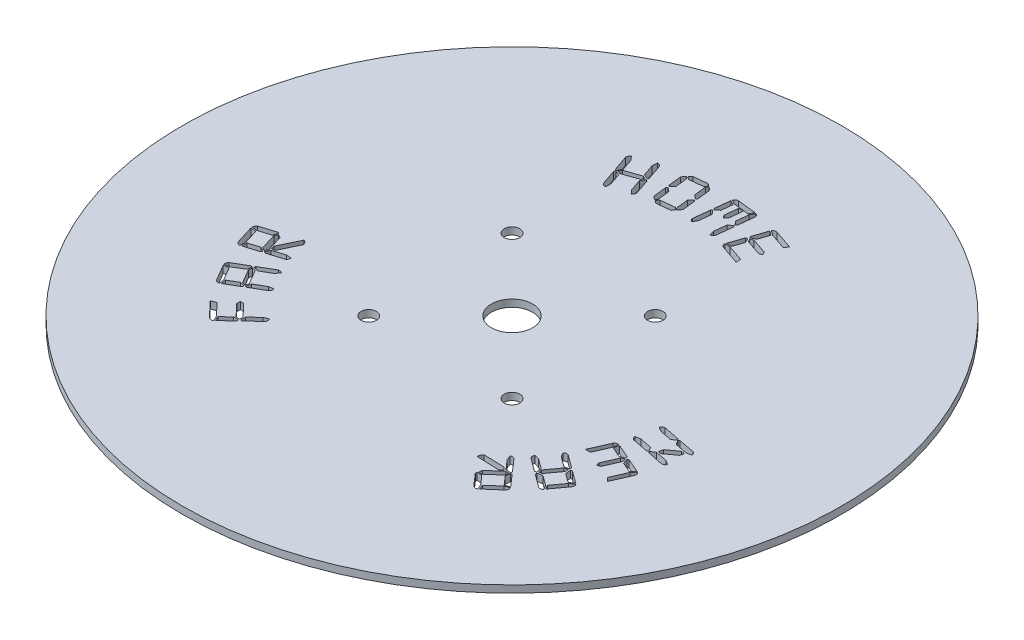
from build123d import *

# Parameters (mm, degrees)
SKETCH1_R           = 146.05
BOSS_EXTRUDE1_DEPTH = 3.175
SKETCH2_R           = 9.144
CUT_EXTRUDE1_DEPTH  = 3.175
SKETCH3_R           = 3.429
CUT_EXTRUDE2_DEPTH  = 3.175


with BuildPart() as part:
    # Sketch1 → Boss-Extrude1 (new body)
    with BuildSketch(Plane(origin=(0, 0, 0), x_dir=(1, 0, 0), z_dir=(0, 1, 0))):
        with Locations(Location((0, 0, 0), (0, 0, 270))):
            Circle(SKETCH1_R)
    extrude(amount=BOSS_EXTRUDE1_DEPTH)

    # Sketch2 → Cut-Extrude1 (cut)
    with BuildSketch(Plane(origin=(0, 3.175, 0), x_dir=(1, 0, 0), z_dir=(0, 1, 0))):
        with Locations(Location((0, 0, 0), (0, 0, 270))):
            Circle(SKETCH2_R)
        Polygon((31.408223038, 80.361871535), (32.15043083, 79.075378028), (30.773223038, 78.514598807), (23.89543083, 80.869046859), (23.153223038, 82.155540366), (24.53043083, 82.716319587), align=None)
        with BuildLine():
            Line((29.115625636, 70.238981924), (20.386437324, 73.228429976))
            add(Edge.make_bspline(
                [(20.386437324, 73.228429976), (20.308206491, 73.278910533), (20.158632768, 73.375427014), (19.960506837, 73.544292639), (19.793265108, 73.725547843), (19.66155019, 73.924112009), (19.561410759, 74.133968766), (19.487899467, 74.354938057), (19.457107157, 74.592381126), (19.458146887, 74.754035519), (19.458677584, 74.836546859)],
                knots=[0, 0, 0, 0, 1.139239353, 2.178172795, 3.179182683, 4.150304919, 5.083936223, 6.020900313, 6.98983155, 8, 8, 8, 8], degree=3))
            Line((19.458677584, 74.836546859), (21.809002259, 74.803559846))
            Line((21.809002259, 74.803559846), (28.954813947, 72.358397509))
            Line((28.954813947, 72.358397509), (29.115625636, 70.238981924))
        make_face()
        Polygon((19.619489272, 75.294241665), (21.800755506, 81.664858548), (22.497606155, 81.978235171), (23.57793083, 79.966027379), (21.982184077, 75.306611794), align=None)
        with BuildLine():
            Line((33.754424337, 86.340767639), (26.633352908, 88.777683223))
            Line((26.633352908, 88.777683223), (24.753093168, 90.196124781))
            add(Edge.make_bspline(
                [(24.753093168, 90.196124781), (24.801752832, 90.262669387), (24.897037259, 90.392975763), (25.075834585, 90.553073898), (25.264048274, 90.691978942), (25.473327199, 90.796146713), (25.699182363, 90.865799675), (25.941692479, 90.906850852), (26.202039321, 90.91931368), (26.380524095, 90.904655681), (26.47254122, 90.897098807)],
                knots=[0, 0, 0, 0, 1.006787646, 1.97147236, 2.924338132, 3.865236511, 4.818102283, 5.808721278, 6.870294853, 8, 8, 8, 8], degree=3))
            Line((26.47254122, 90.897098807), (35.176989272, 87.915897509))
            Line((35.176989272, 87.915897509), (33.754424337, 86.340767639))
        make_face()
        Polygon((26.427184077, 88.287001405), (24.835560701, 83.631709197), (22.745008753, 82.703949457), (22.386274986, 83.37193647), (24.56754122, 89.742553353), align=None)
        Polygon((10.423649508, 85.353448722), (9.252610547, 84.438059112), (8.312480677, 85.58848119), (8.963974183, 91.509650021), (11.075143014, 91.274617553), align=None)
        with BuildLine():
            Line((14.530532625, 83.856663008), (15.004720936, 83.287637034))
            Line((15.004720936, 83.287637034), (14.204785871, 76.07585132))
            add(Edge.make_bspline(
                [(14.204785871, 76.07585132), (14.172673007, 75.996398713), (14.109767556, 75.840760084), (13.979009278, 75.630349221), (13.831498412, 75.441311804), (13.656191061, 75.28375158), (13.459234008, 75.155237654), (13.242543941, 75.049869316), (13.001438811, 74.976666806), (12.832092118, 74.948264352), (12.745110547, 74.933675995)],
                knots=[0, 0, 0, 0, 1.048160122, 2.053226586, 3.023696917, 3.977513798, 4.925664685, 5.897303201, 6.919991485, 8, 8, 8, 8], degree=3))
            Line((12.745110547, 74.933675995), (12.180207949, 77.081955216))
            Line((12.180207949, 77.081955216), (12.77809756, 82.487701969))
            Line((12.77809756, 82.487701969), (14.530532625, 83.856663008))
        make_face()
        with BuildLine():
            Line((13.169818339, 91.447799371), (6.370370287, 92.198253917))
            Line((6.370370287, 92.198253917), (4.345792365, 93.224974696))
            add(Edge.make_bspline(
                [(4.345792365, 93.224974696), (4.380560264, 93.307246191), (4.448329292, 93.467608465), (4.586792176, 93.682965096), (4.745731724, 93.871773528), (4.926549488, 94.035761754), (5.138481934, 94.160883719), (5.36486679, 94.272773568), (5.62087693, 94.344865074), (5.799643588, 94.373146546), (5.892058599, 94.387766904)],
                knots=[0, 0, 0, 0, 1.04758277, 2.041931492, 2.992863463, 3.942149272, 4.891984118, 5.874199749, 6.901048696, 8, 8, 8, 8], degree=3))
            Line((5.892058599, 94.387766904), (14.258389768, 93.46413054))
            Line((14.258389768, 93.46413054), (13.169818339, 91.447799371))
        make_face()
        Polygon((6.312643014, 91.686955216), (5.772480677, 86.79663054), (4.020045612, 85.427669501), (3.549980677, 86.000818852), (4.288065092, 92.697182488), align=None)
        with BuildLine():
            Line((13.161571586, 85.976078592), (13.759461196, 91.381825345))
            Line((13.759461196, 91.381825345), (14.777935222, 93.356922748))
            add(Edge.make_bspline(
                [(14.777935222, 93.356922748), (14.860253989, 93.325072433), (15.020345313, 93.263130797), (15.234334111, 93.130750272), (15.428713683, 92.988275135), (15.590322893, 92.816851551), (15.723157178, 92.624115794), (15.832793132, 92.41161178), (15.909598712, 92.1757657), (15.941150471, 92.01035883), (15.957220936, 91.92611106)],
                knots=[0, 0, 0, 0, 1.079803383, 2.099972567, 3.07400507, 4.02756035, 4.971838706, 5.936496843, 6.948982343, 8, 8, 8, 8], degree=3))
            Line((15.957220936, 91.92611106), (15.161409248, 84.714325345))
            Line((15.161409248, 84.714325345), (14.575889768, 84.25663054))
            Line((14.575889768, 84.25663054), (13.161571586, 85.976078592))
        make_face()
        with BuildLine():
            Line((5.389006651, 83.30413054), (4.79111704, 77.898383787))
            Line((4.79111704, 77.898383787), (3.772643014, 75.923286384))
            add(Edge.make_bspline(
                [(3.772643014, 75.923286384), (3.690392531, 75.955225339), (3.530434004, 76.017339358), (3.314785633, 76.148939266), (3.123167691, 76.296385835), (2.960092385, 76.467242852), (2.82736807, 76.660250882), (2.718777619, 76.87166896), (2.639648443, 77.106811176), (2.609137488, 77.272518203), (2.5933573, 77.358221449)],
                knots=[0, 0, 0, 0, 1.078346281, 2.097138835, 3.080138305, 4.032406844, 4.975410977, 5.938767391, 6.933935817, 8, 8, 8, 8], degree=3))
            Line((2.5933573, 77.358221449), (3.393292365, 84.570007164))
            Line((3.393292365, 84.570007164), (3.974688469, 85.023578592))
            Line((3.974688469, 85.023578592), (5.389006651, 83.30413054))
        make_face()
        Polygon((-7.079524436, 92.118706184), (-13.194491968, 91.442472418), (-14.423258202, 92.374355535), (-13.429524436, 93.553641249), (-7.314556903, 94.229875015), (-6.085790669, 93.297991898), align=None)
        Polygon((-5.945595864, 86.890264625), (-6.543485475, 92.296011379), (-5.838388072, 93.157797093), (-4.374589371, 92.011498392), (-3.723095864, 86.090329561), (-4.193160799, 85.51718021), align=None)
        Polygon((-4.135433526, 85.001758132), (-3.554037423, 84.548186703), (-2.898420539, 78.622894496), (-4.073582877, 77.192082807), (-4.951862098, 77.880686703), (-5.549751708, 83.286433457), align=None)
        Polygon((-14.749004955, 84.350264625), (-15.334524436, 84.807959431), (-15.986017942, 90.729128262), (-14.810855604, 92.168186703), (-13.932576384, 91.479582807), (-13.334686773, 86.073836054), align=None)
        Polygon((-4.279751708, 76.936433457), (-5.273485475, 75.757147742), (-11.388453007, 75.080913976), (-12.617219241, 76.012797093), (-11.623485475, 77.192082807), (-5.508517942, 77.868316574), align=None)
        Polygon((-12.938842617, 82.470004885), (-12.340953007, 77.064258132), (-13.04605041, 76.202472418), (-14.509849111, 77.340524366), (-15.165465994, 83.265816574), (-14.691277682, 83.834842548), align=None)
        Polygon((-24.53915595, 82.708315981), (-23.161948157, 82.14753676), (-23.90415595, 80.861043254), (-30.765454651, 78.510718578), (-32.142662443, 79.071497799), (-31.400454651, 80.357991306), align=None)
        with BuildLine():
            Line((-22.54756504, 82.060945851), (-21.850714391, 81.751692604))
            Line((-21.850714391, 81.751692604), (-19.504513092, 74.890393903))
            add(Edge.make_bspline(
                [(-19.504513092, 74.890393903), (-19.500255122, 74.803700992), (-19.491906571, 74.633723221), (-19.528501415, 74.385706992), (-19.588584886, 74.15179337), (-19.685062054, 73.932420803), (-19.820014424, 73.731209754), (-19.980965711, 73.539306873), (-20.176827324, 73.364362585), (-20.326415823, 73.266614201), (-20.403409196, 73.216302994)],
                knots=[0, 0, 0, 0, 1.03485545, 2.029028921, 2.981208129, 3.915079991, 4.876282124, 5.866785792, 6.902032171, 8, 8, 8, 8], degree=3))
            Line((-20.403409196, 73.216302994), (-21.867207898, 74.902764033))
            Line((-21.867207898, 74.902764033), (-23.627889716, 80.052861435))
            Line((-23.627889716, 80.052861435), (-22.54756504, 82.060945851))
        make_face()
        with BuildLine():
            Line((-24.815422183, 83.520621176), (-26.580227378, 88.666595202))
            Line((-26.580227378, 88.666595202), (-26.456526079, 90.897341955))
            add(Edge.make_bspline(
                [(-26.456526079, 90.897341955), (-26.36447494, 90.903503134), (-26.185780776, 90.915463515), (-25.923828073, 90.899262998), (-25.678699697, 90.851414713), (-25.452677506, 90.765178439), (-25.240055653, 90.656247482), (-25.048428008, 90.506339271), (-24.869804588, 90.330992969), (-24.770855551, 90.192505612), (-24.720584521, 90.12214715)],
                knots=[0, 0, 0, 0, 1.101477507, 2.138241894, 3.127067975, 4.072811047, 5.020548458, 5.969849911, 6.968582821, 8, 8, 8, 8], degree=3))
            Line((-24.720584521, 90.12214715), (-22.370259846, 83.260848448))
            Line((-22.370259846, 83.260848448), (-22.728993612, 82.588738059))
            Line((-22.728993612, 82.588738059), (-24.815422183, 83.520621176))
        make_face()
        with BuildLine():
            Line((-30.489188417, 77.70253676), (-28.728506599, 72.552439358))
            Line((-28.728506599, 72.552439358), (-28.848084521, 70.321692604))
            add(Edge.make_bspline(
                [(-28.848084521, 70.321692604), (-28.940134055, 70.315533389), (-29.118825102, 70.303576819), (-29.380799791, 70.319750448), (-29.625850503, 70.367693715), (-29.852148228, 70.453593017), (-30.064724994, 70.564282167), (-30.260209692, 70.709740836), (-30.434423511, 70.890851956), (-30.536002015, 71.026995358), (-30.588149456, 71.09688741)],
                knots=[0, 0, 0, 0, 1.099883159, 2.135146866, 3.122541658, 4.0669158, 5.013281396, 5.974311456, 6.960070584, 8, 8, 8, 8], degree=3))
            Line((-30.588149456, 71.09688741), (-32.934350755, 77.958186111))
            Line((-32.934350755, 77.958186111), (-32.575616989, 78.626173124))
            Line((-32.575616989, 78.626173124), (-30.489188417, 77.70253676))
        make_face()
        with BuildLine():
            Line((-32.662207898, 78.873575721), (-33.35493517, 79.182828968))
            Line((-33.35493517, 79.182828968), (-35.705259846, 86.048251046))
            add(Edge.make_bspline(
                [(-35.705259846, 86.048251046), (-35.707156155, 86.134854204), (-35.710870722, 86.304495981), (-35.684207725, 86.553991225), (-35.615682881, 86.786264267), (-35.520375091, 87.005009763), (-35.390275764, 87.208703291), (-35.228524192, 87.39913983), (-35.033022777, 87.574336411), (-34.883383336, 87.672049114), (-34.806363742, 87.722341955)],
                knots=[0, 0, 0, 0, 1.035588221, 2.028552177, 2.985910406, 3.920561255, 4.873676481, 5.865006376, 6.901116304, 8, 8, 8, 8], degree=3))
            Line((-34.806363742, 87.722341955), (-33.34256504, 86.031757539))
            Line((-33.34256504, 86.031757539), (-31.581883222, 80.885783513))
            Line((-31.581883222, 80.885783513), (-32.662207898, 78.873575721))
        make_face()
        with BuildLine():
            Line((82.558437556, -12.328711558), (77.218664829, -11.281373896))
            Line((77.218664829, -11.281373896), (75.342528465, -10.089718052))
            add(Edge.make_bspline(
                [(75.342528465, -10.089718052), (75.381969699, -10.010389028), (75.459285813, -9.854881424), (75.602838317, -9.64368018), (75.77006906, -9.465060777), (75.952821702, -9.314789289), (76.154692622, -9.19199948), (76.377411998, -9.101824926), (76.619758246, -9.044809242), (76.786822009, -9.026836164), (76.872301192, -9.01764013)],
                knots=[0, 0, 0, 0, 1.077100359, 2.111425155, 3.09346939, 4.044118245, 4.981884883, 5.956928204, 6.954649983, 8, 8, 8, 8], degree=3))
            Line((76.872301192, -9.01764013), (83.993372621, -10.415464805))
            Line((83.993372621, -10.415464805), (84.39746353, -11.042218052))
            Line((84.39746353, -11.042218052), (82.558437556, -12.328711558))
        make_face()
        Polygon((84.550028465, -19.688938831), (84.925255738, -17.767445325), (89.547560932, -14.40277), (91.073210283, -14.699653117), (90.751586906, -16.34488039), (85.820028465, -19.940464805), align=None)
        with BuildLine():
            Line((82.323405088, -21.598062208), (81.713145348, -22.026893377))
            Line((81.713145348, -22.026893377), (74.592073919, -20.629068701))
            add(Edge.make_bspline(
                [(74.592073919, -20.629068701), (74.515034937, -20.590197585), (74.364215393, -20.514099435), (74.167312399, -20.36260978), (73.994394178, -20.197178811), (73.852931328, -20.009073481), (73.739962531, -19.800631002), (73.660049636, -19.571811032), (73.597501933, -19.325094346), (73.587191668, -19.151947789), (73.581846647, -19.062185584)],
                knots=[0, 0, 0, 0, 1.049427017, 2.054467743, 3.013946857, 3.958691079, 4.910536517, 5.890844859, 6.90657707, 8, 8, 8, 8], degree=3))
            Line((73.581846647, -19.062185584), (75.771359634, -18.670464805))
            Line((75.771359634, -18.670464805), (81.111132361, -19.717802468))
            Line((81.111132361, -19.717802468), (82.323405088, -21.598062208))
        make_face()
        with BuildLine():
            Line((84.310872621, -20.344555714), (89.650645348, -21.391893377))
            Line((89.650645348, -21.391893377), (91.526781712, -22.583549221))
            add(Edge.make_bspline(
                [(91.526781712, -22.583549221), (91.487340477, -22.662878245), (91.410024363, -22.818385849), (91.26647186, -23.029587092), (91.099241117, -23.208206496), (90.916488474, -23.358477983), (90.714617555, -23.481267793), (90.491898179, -23.571442347), (90.249551931, -23.62845803), (90.082488167, -23.646431109), (89.997008984, -23.655627143)],
                knots=[0, 0, 0, 0, 1.077100359, 2.111425155, 3.09346939, 4.044118245, 4.981884883, 5.956928204, 6.954649983, 8, 8, 8, 8], degree=3))
            Line((89.997008984, -23.655627143), (82.875937556, -22.257802468))
            Line((82.875937556, -22.257802468), (82.471846647, -21.631049221))
            Line((82.471846647, -21.631049221), (84.310872621, -20.344555714))
        make_face()
        with BuildLine():
            Line((84.545905088, -11.075205065), (85.156164829, -10.646373896))
            Line((85.156164829, -10.646373896), (92.277236257, -12.044198571))
            add(Edge.make_bspline(
                [(92.277236257, -12.044198571), (92.354275239, -12.083069688), (92.505094783, -12.159167837), (92.701997777, -12.310657493), (92.874915999, -12.476088462), (93.016378849, -12.664193792), (93.129347646, -12.872636271), (93.209260541, -13.101456241), (93.271808244, -13.348172927), (93.282118508, -13.521319484), (93.28746353, -13.611081688)],
                knots=[0, 0, 0, 0, 1.049427017, 2.054467743, 3.013946857, 3.958691079, 4.910536517, 5.890844859, 6.90657707, 8, 8, 8, 8], degree=3))
            Line((93.28746353, -13.611081688), (91.097950543, -14.002802468))
            Line((91.097950543, -14.002802468), (85.758177816, -12.955464805))
            Line((85.758177816, -12.955464805), (84.545905088, -11.075205065))
        make_face()
        Polygon((77.51950198, -37.996402012), (76.146417564, -38.610785128), (75.672229253, -37.184096817), (78.595703279, -30.52484357), (79.968787694, -29.906337077), (80.442976006, -31.337148765), align=None)
        with BuildLine():
            Line((67.528560422, -34.940979934), (71.239599383, -26.492181232))
            add(Edge.make_bspline(
                [(71.239599383, -26.492181232), (71.297259246, -26.419504055), (71.408699904, -26.27903906), (71.594422193, -26.09424938), (71.796583537, -25.949315959), (72.005358487, -25.831065835), (72.229332184, -25.75362577), (72.461528879, -25.70150036), (72.706725934, -25.690056839), (72.87122111, -25.707904626), (72.954924058, -25.716986427)],
                knots=[0, 0, 0, 0, 1.120273106, 2.165179787, 3.151461348, 4.117410847, 5.052180739, 6.00303073, 6.98384731, 8, 8, 8, 8], degree=3))
            Line((72.954924058, -25.716986427), (72.748755227, -28.071434479))
            Line((72.748755227, -28.071434479), (69.713950032, -34.986337077))
            Line((69.713950032, -34.986337077), (67.528560422, -34.940979934))
        make_face()
        Polygon((73.445605876, -25.857181232), (79.610053928, -28.562116297), (79.849209772, -29.300200713), (77.733917564, -30.260947466), (73.227066915, -28.281726687), align=None)
        with BuildLine():
            Line((83.213885097, -40.800298115), (86.236320162, -33.910135778))
            Line((86.236320162, -33.910135778), (87.827943538, -32.170070843))
            add(Edge.make_bspline(
                [(87.827943538, -32.170070843), (87.891181956, -32.226367857), (88.014929496, -32.336532172), (88.174156316, -32.523510621), (88.298308907, -32.727026653), (88.391193058, -32.944886894), (88.4483462, -33.177395514), (88.472888605, -33.424386171), (88.463719222, -33.684755866), (88.435968297, -33.860877574), (88.421709772, -33.951369544)],
                knots=[0, 0, 0, 0, 1.023695996, 2.003210457, 2.958712158, 3.897717058, 4.857694877, 5.843962749, 6.892220264, 8, 8, 8, 8], degree=3))
            Line((88.421709772, -33.951369544), (84.723040941, -42.375427986))
            Line((84.723040941, -42.375427986), (83.213885097, -40.800298115))
        make_face()
        Polygon((85.72502146, -33.765817596), (81.218170811, -31.790720193), (80.488333149, -29.580590323), (81.197553928, -29.263090323), (87.366125357, -31.968025388), align=None)
        Polygon((67.260467223, -53.75636442), (65.804915275, -54.077987796), (65.6770906, -52.593572212), (69.940662028, -46.787857926), (71.396213976, -46.466234549), (71.524038652, -47.950650134), align=None)
        with BuildLine():
            Line((65.367837353, -54.502695588), (64.613259431, -54.6593839))
            Line((64.613259431, -54.6593839), (58.766311379, -50.362825459))
            add(Edge.make_bspline(
                [(58.766311379, -50.362825459), (58.714527831, -50.292794015), (58.613312011, -50.155910964), (58.502700466, -49.929141097), (58.422023312, -49.698241409), (58.381693185, -49.458740445), (58.37197123, -49.212939077), (58.404201088, -48.959721545), (58.463838616, -48.698216029), (58.532917899, -48.528486218), (58.568389301, -48.441331952)],
                knots=[0, 0, 0, 0, 1.023861516, 2.001233735, 2.958557941, 3.895405216, 4.851085475, 5.845075209, 6.893471406, 8, 8, 8, 8], degree=3))
            Line((58.568389301, -48.441331952), (60.749655535, -48.977370913))
            Line((60.749655535, -48.977370913), (65.132804886, -52.193604679))
            Line((65.132804886, -52.193604679), (65.367837353, -54.502695588))
        make_face()
        with BuildLine():
            Line((72.860012678, -57.195260523), (76.80196073, -51.830747536))
            Line((76.80196073, -51.830747536), (78.752317873, -50.420552731))
            add(Edge.make_bspline(
                [(78.752317873, -50.420552731), (78.801501688, -50.487804934), (78.897618254, -50.619231316), (78.997861223, -50.837746389), (79.076541355, -51.057419359), (79.114001008, -51.289242995), (79.110553503, -51.527780802), (79.084089081, -51.773738352), (79.014485376, -52.025018702), (78.947827517, -52.190127034), (78.913129561, -52.276072212)],
                knots=[0, 0, 0, 0, 1.014523562, 1.982614025, 2.921773278, 3.856876967, 4.830043214, 5.82693128, 6.868834924, 8, 8, 8, 8], degree=3))
            Line((78.913129561, -52.276072212), (73.952707483, -59.030163121))
            Line((73.952707483, -59.030163121), (72.860012678, -57.195260523))
        make_face()
        Polygon((76.373129561, -51.513247536), (72.406441249, -48.60214364), (72.171408782, -46.293052731), (72.93011008, -46.140487796), (78.356473717, -50.127792991), align=None)
        with BuildLine():
            Line((68.151116574, -54.411981303), (72.538389301, -57.636461822))
            Line((72.538389301, -57.636461822), (73.697058132, -59.553831952))
            add(Edge.make_bspline(
                [(73.697058132, -59.553831952), (73.624060045, -59.613203103), (73.482065206, -59.72869102), (73.254355474, -59.870142817), (73.021579889, -59.97498414), (72.78397786, -60.042493906), (72.54329146, -60.070311157), (72.299085832, -60.066665058), (72.051145225, -60.02623444), (71.890329562, -59.970017018), (71.808551639, -59.941429355)],
                knots=[0, 0, 0, 0, 1.108323099, 2.155894279, 3.149456626, 4.108608698, 5.055089049, 5.994890243, 6.980362313, 8, 8, 8, 8], degree=3))
            Line((71.808551639, -59.941429355), (65.961603587, -55.64899429))
            Line((65.961603587, -55.64899429), (65.879136054, -54.877922861))
            Line((65.879136054, -54.877922861), (68.151116574, -54.411981303))
        make_face()
        with BuildLine():
            Line((69.396376314, -46.387890394), (65.013226963, -43.171656627))
            Line((65.013226963, -43.171656627), (63.850434756, -41.250163121))
            add(Edge.make_bspline(
                [(63.850434756, -41.250163121), (63.923303802, -41.190579682), (64.065955908, -41.073936146), (64.296589657, -40.934991815), (64.529936005, -40.828846397), (64.767664509, -40.76154396), (65.008317917, -40.733672627), (65.252532361, -40.737333176), (65.500470528, -40.777759795), (65.66128653, -40.833977773), (65.743064626, -40.862565718)],
                knots=[0, 0, 0, 0, 1.106412501, 2.165968719, 3.1578183, 4.115316925, 5.060165673, 5.998346778, 6.982120029, 8, 8, 8, 8], degree=3))
            Line((65.743064626, -40.862565718), (71.590012678, -45.15912416))
            Line((71.590012678, -45.15912416), (71.668356834, -45.926072212))
            Line((71.668356834, -45.926072212), (69.396376314, -46.387890394))
        make_face()
        Polygon((54.105244096, -67.442212602), (52.575471369, -67.38448533), (52.723912927, -65.858835979), (58.265731109, -61.0221152), (59.799627213, -61.083965849), (59.647062278, -62.605491823), align=None)
        with BuildLine():
            Line((57.366835005, -60.968511304), (56.100958382, -62.069452862))
            Line((56.100958382, -62.069452862), (46.295568772, -61.685978836))
            add(Edge.make_bspline(
                [(46.295568772, -61.685978836), (46.275356643, -61.592930339), (46.235532656, -61.40959675), (46.240751508, -61.127743371), (46.278828613, -60.848564145), (46.373570182, -60.573874136), (46.511440017, -60.303660437), (46.696745053, -60.037021172), (46.927932754, -59.774489729), (47.106278803, -59.610307788), (47.198588252, -59.525329486)],
                knots=[0, 0, 0, 0, 0.920355924, 1.81337861, 2.716293298, 3.643572181, 4.615196696, 5.650382614, 6.783870538, 8, 8, 8, 8], degree=3))
            Line((47.198588252, -59.525329486), (56.344237603, -59.797472343))
            Line((56.344237603, -59.797472343), (57.366835005, -60.968511304))
        make_face()
        with BuildLine():
            Line((57.680211629, -60.35000481), (54.105244096, -56.251368447))
            Line((54.105244096, -56.251368447), (53.334172668, -54.173186628))
            add(Edge.make_bspline(
                [(53.334172668, -54.173186628), (53.413102312, -54.135618332), (53.566259651, -54.062719735), (53.80415793, -53.986095589), (54.040603559, -53.94996239), (54.275452169, -53.943797128), (54.507409921, -53.978530372), (54.736031737, -54.045436433), (54.963097898, -54.145211369), (55.104301721, -54.237033897), (55.177322018, -54.284517797)],
                knots=[0, 0, 0, 0, 1.074397234, 2.084791114, 3.060221579, 4.006963174, 4.963164162, 5.931391441, 6.930266838, 8, 8, 8, 8], degree=3))
            Line((55.177322018, -54.284517797), (59.943945395, -59.747991823))
            Line((59.943945395, -59.747991823), (59.890341499, -60.486076239))
            Line((59.890341499, -60.486076239), (57.680211629, -60.35000481))
        make_face()
        with BuildLine():
            Line((58.45952981, -71.544972343), (63.560146694, -67.091725589))
            Line((63.560146694, -67.091725589), (65.663068772, -66.304160654))
            add(Edge.make_bspline(
                [(65.663068772, -66.304160654), (65.699922084, -66.384330494), (65.771933755, -66.540983013), (65.835729373, -66.786408121), (65.871818545, -67.028635924), (65.866803924, -67.270757326), (65.825873636, -67.511571847), (65.743772608, -67.74856088), (65.63419307, -67.986206468), (65.533398688, -68.133516246), (65.4816402, -68.209160654)],
                knots=[0, 0, 0, 0, 1.045424858, 2.042768673, 2.997989442, 3.944391954, 4.904615368, 5.884865594, 6.913866458, 8, 8, 8, 8], degree=3))
            Line((65.4816402, -68.209160654), (59.205860979, -73.68500481))
            Line((59.205860979, -73.68500481), (58.45952981, -71.544972343))
        make_face()
        with BuildLine():
            Line((54.443360979, -67.829810005), (58.018328512, -71.928446369))
            Line((58.018328512, -71.928446369), (58.78939994, -74.010751563))
            add(Edge.make_bspline(
                [(58.78939994, -74.010751563), (58.710616908, -74.048796177), (58.558107834, -74.122443365), (58.318621969, -74.192503799), (58.08306949, -74.230178914), (57.848093584, -74.235930394), (57.616170003, -74.201308224), (57.387538845, -74.134371797), (57.160475266, -74.034605253), (57.019271076, -73.942781534), (56.94625059, -73.895297018)],
                knots=[0, 0, 0, 0, 1.075063899, 2.08112072, 3.057156441, 4.00448549, 4.961279802, 5.930107867, 6.929603068, 8, 8, 8, 8], degree=3))
            Line((56.94625059, -73.895297018), (52.179627213, -68.431822992))
            Line((52.179627213, -68.431822992), (52.233231109, -67.693738576))
            Line((52.233231109, -67.693738576), (54.443360979, -67.829810005))
        make_face()
        Polygon((63.22202981, -66.704128187), (59.985179161, -62.993089226), (60.150114226, -60.787082732), (60.888198642, -60.832439875), (65.316705135, -65.908316499), align=None)
        Polygon((-65.766348353, -56.210588547), (-65.749854847, -54.64370543), (-64.18297173, -54.717926209), (-59.152452249, -60.057698936), (-59.168945756, -61.62870543), (-60.735828873, -61.550361274), align=None)
        with BuildLine():
            Line((-70.479367834, -60.202017118), (-65.271543159, -65.727341794))
            Line((-65.271543159, -65.727341794), (-64.314919782, -67.933348287))
            add(Edge.make_bspline(
                [(-64.314919782, -67.933348287), (-64.396423846, -67.974153607), (-64.554227582, -68.05315865), (-64.803110777, -68.131243705), (-65.049488911, -68.180124209), (-65.298498879, -68.181129841), (-65.545923284, -68.154306687), (-65.792598082, -68.08561535), (-66.038374431, -67.982238281), (-66.193568214, -67.887380913), (-66.273523678, -67.838510625)],
                knots=[0, 0, 0, 0, 1.05534509, 2.043301768, 3.015576628, 3.956108689, 4.918931016, 5.893293985, 6.914630111, 8, 8, 8, 8], degree=3))
            Line((-66.273523678, -67.838510625), (-72.644140561, -61.080296339))
            Line((-72.644140561, -61.080296339), (-70.479367834, -60.202017118))
        make_face()
        Polygon((-64.85508212, -65.434582053), (-61.275991211, -62.061659975), (-59.024627574, -62.181237897), (-59.028750951, -62.931692443), (-63.927322379, -67.549874261), align=None)
        with BuildLine():
            Line((-58.550439262, -59.492796339), (-54.591997704, -55.761140495))
            Line((-54.591997704, -55.761140495), (-52.522062639, -54.932341794))
            add(Edge.make_bspline(
                [(-52.522062639, -54.932341794), (-52.480281054, -55.012562894), (-52.399296419, -55.168054279), (-52.312761804, -55.409222467), (-52.256158845, -55.646931512), (-52.239289031, -55.88510171), (-52.261763443, -56.122355088), (-52.314528526, -56.358966411), (-52.406671233, -56.59175803), (-52.491275349, -56.738001337), (-52.534432769, -56.812601534)],
                knots=[0, 0, 0, 0, 1.092218937, 2.117031997, 3.088331911, 4.037643786, 4.988263154, 5.959563068, 6.959152385, 8, 8, 8, 8], degree=3))
            Line((-52.534432769, -56.812601534), (-57.812354847, -61.785393742))
            Line((-57.812354847, -61.785393742), (-58.562809392, -61.744159975))
            Line((-58.562809392, -61.744159975), (-58.550439262, -59.492796339))
        make_face()
        Polygon((-76.153856897, -40.60611043), (-75.799246507, -39.092831209), (-74.30658417, -39.525785754), (-70.591421832, -45.859292248), (-70.941908845, -47.376694845), (-72.438694559, -46.939616923), align=None)
        with BuildLine():
            Line((-75.815740014, -38.548545495), (-75.638434819, -37.822831209))
            Line((-75.638434819, -37.822831209), (-69.383272481, -34.153026014))
            add(Edge.make_bspline(
                [(-69.383272481, -34.153026014), (-69.298528741, -34.131181566), (-69.134840314, -34.088987495), (-68.885925176, -34.069734845), (-68.647174785, -34.08067126), (-68.415491099, -34.127775797), (-68.192621235, -34.205284743), (-67.978150709, -34.320459785), (-67.771816024, -34.467753058), (-67.648495929, -34.589660689), (-67.585480273, -34.651954585)],
                knots=[0, 0, 0, 0, 1.06404093, 2.055269035, 3.027514268, 3.966474093, 4.924783767, 5.890811887, 6.922220499, 8, 8, 8, 8], degree=3))
            Line((-67.585480273, -34.651954585), (-68.970934819, -36.396142897))
            Line((-68.970934819, -36.396142897), (-73.65921404, -39.146435105))
            Line((-73.65921404, -39.146435105), (-75.815740014, -38.548545495))
        make_face()
        with BuildLine():
            Line((-81.134895858, -44.205818222), (-77.716616637, -50.036272767))
            Line((-77.716616637, -50.036272767), (-77.324895858, -52.29175978))
            add(Edge.make_bspline(
                [(-77.324895858, -52.29175978), (-77.411023654, -52.313655714), (-77.580162365, -52.35665519), (-77.835997025, -52.374687494), (-78.084626013, -52.36455433), (-78.323278296, -52.313693202), (-78.554906908, -52.231126149), (-78.774043881, -52.106973953), (-78.991320589, -51.956857761), (-79.119031748, -51.829363358), (-79.184538715, -51.763967572)],
                knots=[0, 0, 0, 0, 1.042997868, 2.048250648, 3.002998371, 3.960205027, 4.906020045, 5.882407858, 6.913822098, 8, 8, 8, 8], degree=3))
            Line((-79.184538715, -51.763967572), (-83.415123131, -44.556305235))
            Line((-83.415123131, -44.556305235), (-81.134895858, -44.205818222))
        make_face()
        Polygon((-77.279538715, -49.780623417), (-73.032460793, -47.290103936), (-70.875934819, -47.887993546), (-71.053240014, -48.613707832), (-76.863077676, -52.019616923), align=None)
        with BuildLine():
            Line((-76.739376377, -40.952474066), (-81.431778975, -43.702766274))
            Line((-81.431778975, -43.702766274), (-83.625415338, -44.06150004))
            add(Edge.make_bspline(
                [(-83.625415338, -44.06150004), (-83.648198059, -43.975357619), (-83.692231729, -43.808864475), (-83.721309703, -43.556485232), (-83.717986873, -43.313719334), (-83.68093297, -43.08024384), (-83.609470499, -42.855907144), (-83.50075714, -42.643899678), (-83.36392625, -42.436173321), (-83.248117515, -42.314265915), (-83.188337416, -42.251337702)],
                knots=[0, 0, 0, 0, 1.086594402, 2.100132743, 3.090206692, 4.041860042, 4.975746241, 5.951211036, 6.942421696, 8, 8, 8, 8], degree=3))
            Line((-83.188337416, -42.251337702), (-76.929051702, -38.577409131))
            Line((-76.929051702, -38.577409131), (-76.21158417, -38.779454585))
            Line((-76.21158417, -38.779454585), (-76.739376377, -40.952474066))
        make_face()
        with BuildLine():
            Line((-69.944051702, -45.479941598), (-65.255772481, -42.729649391))
            Line((-65.255772481, -42.729649391), (-63.058012741, -42.370915624))
            add(Edge.make_bspline(
                [(-63.058012741, -42.370915624), (-63.035242595, -42.457053359), (-62.99123323, -42.623537445), (-62.961983657, -42.875980639), (-62.965926426, -43.118515502), (-63.0008375, -43.353241942), (-63.080505295, -43.574347952), (-63.180742433, -43.791120182), (-63.324598278, -43.994749315), (-63.439945898, -44.117834229), (-63.49921404, -44.181077962)],
                knots=[0, 0, 0, 0, 1.085598022, 2.098206974, 3.08737305, 4.038153758, 4.976439307, 5.943629152, 6.943391469, 8, 8, 8, 8], degree=3))
            Line((-63.49921404, -44.181077962), (-69.754376377, -47.850883157))
            Line((-69.754376377, -47.850883157), (-70.47184391, -47.652961079))
            Line((-70.47184391, -47.652961079), (-69.944051702, -45.479941598))
        make_face()
        Polygon((-83.581957934, -21.977108114), (-82.860367025, -20.571036686), (-81.470789103, -21.321491231), (-79.268905986, -28.446686036), (-79.990496895, -29.848634088), (-81.380074817, -29.10230292), align=None)
        with BuildLine():
            Line((-78.976146245, -27.642627595), (-79.479198194, -26.026263959))
            Line((-79.479198194, -26.026263959), (-75.199133258, -17.066166556))
            add(Edge.make_bspline(
                [(-75.199133258, -17.066166556), (-75.106116966, -17.089393311), (-74.920468747, -17.135750843), (-74.659166993, -17.256804046), (-74.420678287, -17.422463506), (-74.19924736, -17.624991523), (-74.004690503, -17.877599344), (-73.835142484, -18.172556799), (-73.673468535, -18.503744698), (-73.594878113, -18.745940031), (-73.553905986, -18.872205517)],
                knots=[0, 0, 0, 0, 0.892874552, 1.782059524, 2.667539542, 3.592958597, 4.570128909, 5.627758615, 6.763261831, 8, 8, 8, 8], degree=3))
            Line((-73.553905986, -18.872205517), (-77.487607284, -27.18493279))
            Line((-77.487607284, -27.18493279), (-78.976146245, -27.642627595))
        make_face()
        with BuildLine():
            Line((-78.53082157, -28.219900322), (-73.331243648, -26.611783439))
            Line((-73.331243648, -26.611783439), (-71.104620271, -26.789088634))
            add(Edge.make_bspline(
                [(-71.104620271, -26.789088634), (-71.101155094, -26.881192405), (-71.094468713, -27.058915167), (-71.118826776, -27.318404976), (-71.176468725, -27.560261803), (-71.26753812, -27.783802179), (-71.389347121, -27.988730029), (-71.539583491, -28.177031423), (-71.722451636, -28.34685528), (-71.862013708, -28.442902016), (-71.933418973, -28.492043179)],
                knots=[0, 0, 0, 0, 1.105303982, 2.132786465, 3.116986924, 4.078816268, 5.018031374, 5.96862085, 6.960669153, 8, 8, 8, 8], degree=3))
            Line((-71.933418973, -28.492043179), (-78.864815077, -30.636199023))
            Line((-78.864815077, -30.636199023), (-79.524555336, -30.260971751))
            Line((-79.524555336, -30.260971751), (-78.53082157, -28.219900322))
        make_face()
        with BuildLine():
            Line((-89.214490401, -24.331556166), (-87.185789103, -30.895971751))
            Line((-87.185789103, -30.895971751), (-87.321860531, -33.254543179))
            add(Edge.make_bspline(
                [(-87.321860531, -33.254543179), (-87.414112087, -33.25578541), (-87.593978556, -33.258207435), (-87.855280689, -33.217957543), (-88.101825002, -33.155882976), (-88.327985062, -33.047938635), (-88.539570995, -32.911813744), (-88.734723988, -32.741604393), (-88.909513374, -32.53540573), (-89.009986275, -32.381568773), (-89.061925466, -32.302043179)],
                knots=[0, 0, 0, 0, 1.055232273, 2.057427676, 3.020117639, 3.957221782, 4.913838746, 5.896038216, 6.912362722, 8, 8, 8, 8], degree=3))
            Line((-89.061925466, -32.302043179), (-91.581308583, -24.162497725))
            Line((-91.581308583, -24.162497725), (-89.214490401, -24.331556166))
        make_face()
        with BuildLine():
            Line((-84.192217674, -22.162660062), (-89.387672219, -23.770776946))
            Line((-89.387672219, -23.770776946), (-91.614295596, -23.593471751))
            add(Edge.make_bspline(
                [(-91.614295596, -23.593471751), (-91.617760774, -23.50136798), (-91.624447155, -23.323645218), (-91.600089092, -23.064155408), (-91.542447142, -22.822298581), (-91.451377748, -22.598758205), (-91.329568747, -22.393830355), (-91.179332377, -22.205528961), (-90.996464232, -22.035705105), (-90.85690216, -21.939658369), (-90.785496895, -21.890517205)],
                knots=[0, 0, 0, 0, 1.105303982, 2.132786465, 3.116986924, 4.078816268, 5.018031374, 5.96862085, 6.960669153, 8, 8, 8, 8], degree=3))
            Line((-90.785496895, -21.890517205), (-83.858224168, -19.746361361))
            Line((-83.858224168, -19.746361361), (-83.198483908, -20.121588634))
            Line((-83.198483908, -20.121588634), (-84.192217674, -22.162660062))
        make_face()
        Polygon((-86.707477414, -30.747530192), (-82.006828064, -29.296101621), (-80.031730661, -30.417660062), (-80.361600791, -31.098017205), (-86.794068323, -33.089608114), align=None)
    extrude(amount=-CUT_EXTRUDE1_DEPTH, mode=Mode.SUBTRACT)

    # Sketch3 → Cut-Extrude2 (cut)
    with BuildSketch(Plane.XZ):
        with Locations(Location((-31.75, 31.75, 0), (0, 0, 270))):
            Circle(SKETCH3_R)
        with Locations(Location((31.75, 31.75, 0), (0, 0, 270))):
            Circle(SKETCH3_R)
        with Locations(Location((31.75, -31.75, 0), (0, 0, 270))):
            Circle(SKETCH3_R)
        with Locations(Location((-31.75, -31.75, 0), (0, 0, 270))):
            Circle(SKETCH3_R)
    extrude(amount=-CUT_EXTRUDE2_DEPTH, mode=Mode.SUBTRACT)


solid = part.part
